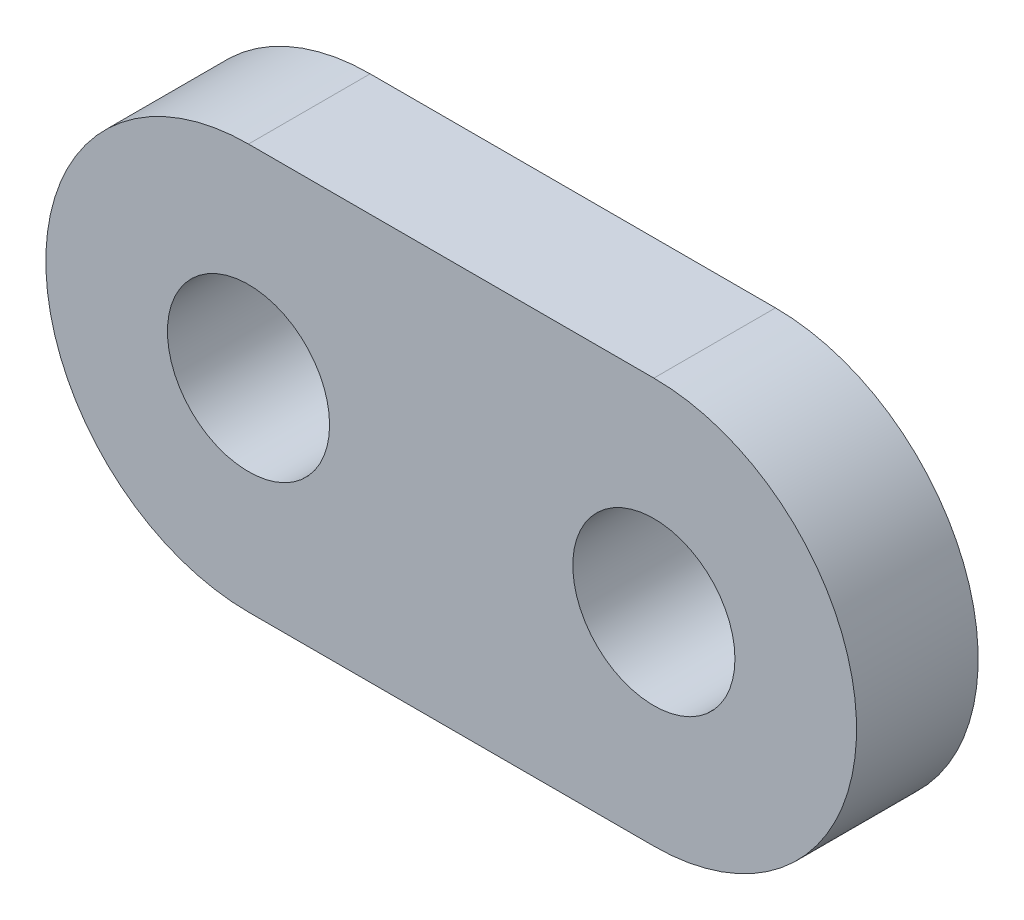
from build123d import *

# Parameters (mm, degrees)
SKETCH1_R           = 2
BOSS_EXTRUDE1_DEPTH = 3


with BuildPart() as part:
    # Sketch1 → Boss-Extrude1 (new body)
    with BuildSketch(Plane.XY):
        with BuildLine():
            Line((-13.402385146, -5), (-3.402385146, -5))
            ThreePointArc((-3.402385146, -5), (1.597614854, 0), (-3.402385146, 5))
            Line((-3.402385146, 5), (-13.402385146, 5))
            ThreePointArc((-13.402385146, 5), (-18.402385146, 0), (-13.402385146, -5))
        make_face()
        with Locations((-13.402385146, 0)):
            Circle(SKETCH1_R, mode=Mode.SUBTRACT)
        with Locations((-3.402385146, 0)):
            Circle(SKETCH1_R, mode=Mode.SUBTRACT)
    extrude(amount=BOSS_EXTRUDE1_DEPTH)


solid = part.part
